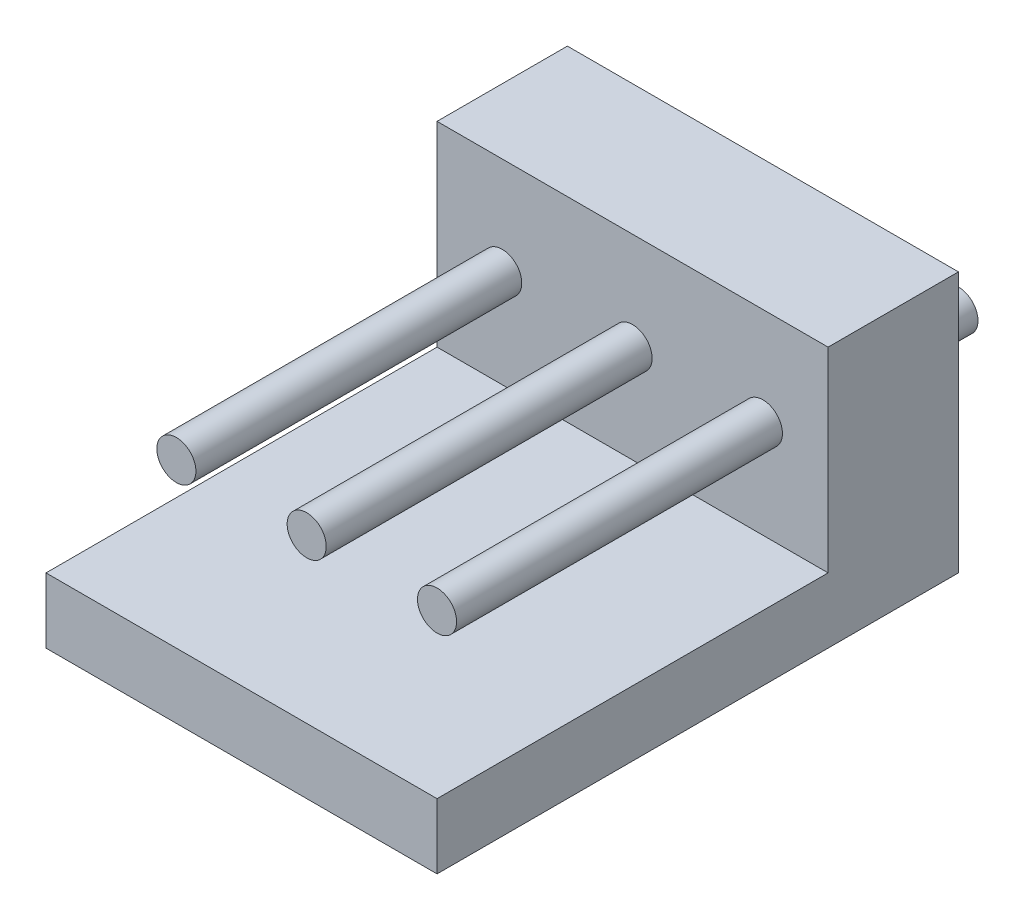
from build123d import *

# Parameters (mm, degrees)
SKETCH_1_W           = 15
SKETCH_1_H           = 10
EXTRUDE_1_DEPTH      = 5
SKETCH_2_W           = 15
SKETCH_2_H           = 2.5
EXTRUDE_2_DEPTH      = 15
EXTRUDE_3_DEPTH      = 12.5
EXTRUDE_3_DEPTH_BACK = 7.5
SKETCH_3_R           = 0.75


with BuildPart() as part:
    # Эскиз1 → Вытянуть1 (new body)
    with BuildSketch(Plane.XY):
        with Locations((7.5, 5)):
            Rectangle(SKETCH_1_W, SKETCH_1_H)
    extrude(amount=EXTRUDE_1_DEPTH)

    # Эскиз2 → Вытянуть2 (add)
    with BuildSketch(Plane.XY.offset(5)):
        with Locations((7.5, 1.25)):
            Rectangle(SKETCH_2_W, SKETCH_2_H)
    extrude(amount=EXTRUDE_2_DEPTH)

    # Эскиз3 → Вытянуть3 (add, two sides: drawn at the far end of the back side and taken through both)
    with BuildSketch(Plane.XY.offset(5).offset(-EXTRUDE_3_DEPTH_BACK)):
        with Locations((7.5, 6.25)):
            Circle(SKETCH_3_R)
        with Locations((12.5, 6.25)):
            Circle(SKETCH_3_R)
        with Locations((2.5, 6.25)):
            Circle(SKETCH_3_R)
    extrude(amount=EXTRUDE_3_DEPTH + EXTRUDE_3_DEPTH_BACK)


solid = part.part
